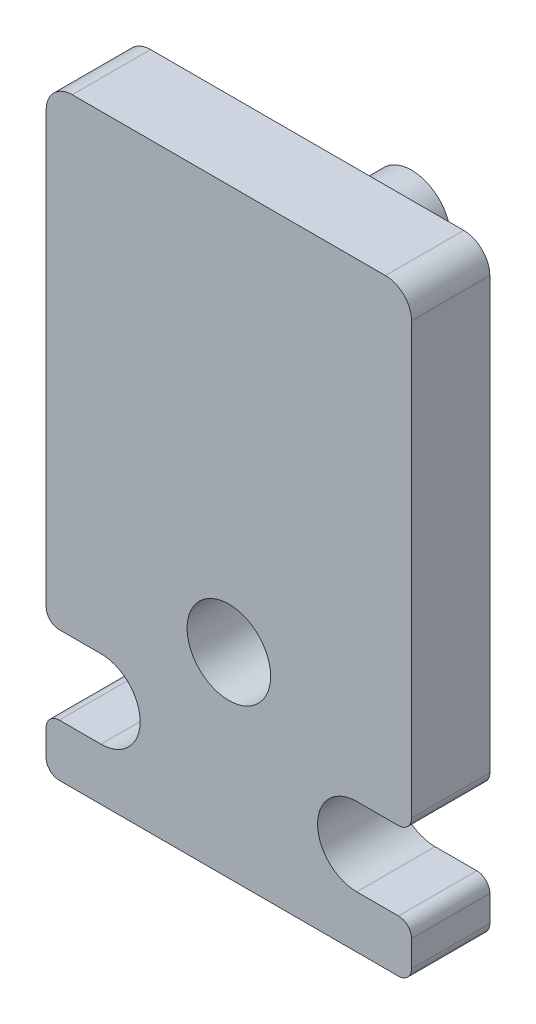
from build123d import *

# Parameters (mm, degrees)
CROQUIS1_R              = 1.6
SALIENTE_EXTRUIR1_DEPTH = 1.5
REDONDEO1_R             = 1
REDONDEO2_R             = 0.5
CROQUIS2_R              = 1.5
SALIENTE_EXTRUIR2_DEPTH = 4


with BuildPart() as part:
    # Croquis1 → Saliente-Extruir1 (new, symmetric)
    with BuildSketch(Plane.XY):
        with BuildLine():
            Line((3, 11.5), (7, 11.5))
            Line((7, 11.5), (7, -6.5))
            Line((7, -6.5), (4.9, -6.5))
            ThreePointArc((4.9, -6.5), (3.4, -8), (4.9, -9.5))
            Line((4.9, -9.5), (7, -9.5))
            Line((7, -9.5), (7, -11.5))
            Line((7, -11.5), (-7, -11.5))
            Line((-7, -11.5), (-7, -9.5))
            Line((-7, -9.5), (-4.9, -9.5))
            ThreePointArc((-4.9, -9.5), (-3.4, -8), (-4.9, -6.5))
            Line((-4.9, -6.5), (-7, -6.5))
            Line((-7, -6.5), (-7, 11.5))
            Line((-7, 11.5), (-3, 11.5))
            Line((-3, 11.5), (3, 11.5))
        make_face()
        with Locations((0, -4)):
            Circle(CROQUIS1_R, mode=Mode.SUBTRACT)
    extrude(amount=SALIENTE_EXTRUIR1_DEPTH, both=True)

    # Redondeo1
    redondeo1_edges = [part.edges().sort_by_distance(p)[0] for p in [
        (-7, 11.5, 0),
        (7, 11.5, 0),
    ]]
    fillet(redondeo1_edges, radius=REDONDEO1_R)

    # Redondeo2
    redondeo2_edges = [part.edges().sort_by_distance(p)[0] for p in [
        (7, -11.5, 0),
        (-7, -11.5, 0),
        (-7, -9.5, 0),
        (-7, -6.5, 0),
        (7, -6.5, 0),
        (7, -9.5, 0),
    ]]
    fillet(redondeo2_edges, radius=REDONDEO2_R)

    # Croquis2 → Saliente-Extruir2 (add)
    with BuildSketch(Plane(origin=(0, 0, -1.5), x_dir=(-1, 0, 0), z_dir=(0, 0, -1))):
        with Locations(Location((0, 7, 0), (0, 0, 180))):
            Circle(CROQUIS2_R)
    extrude(amount=SALIENTE_EXTRUIR2_DEPTH)


solid = part.part
